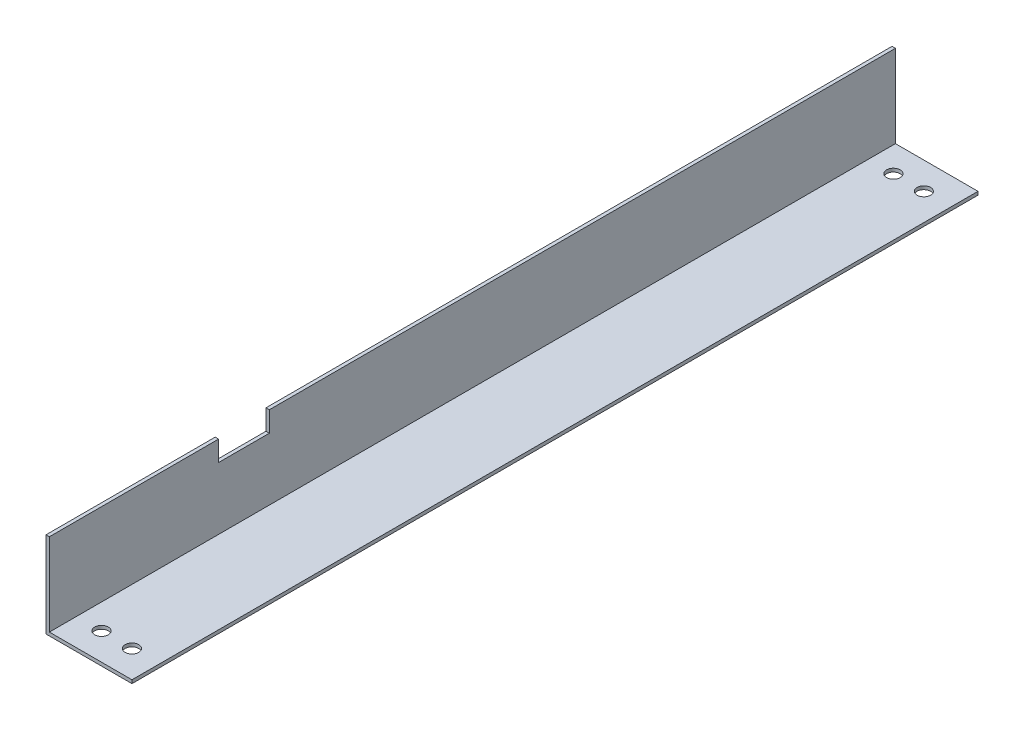
from build123d import *

# Parameters (mm, degrees)
BOSS_EXTRUDE1_DEPTH = 250
SKETCH2_R           = 2
CUT_EXTRUDE1_DEPTH  = 1
SKETCH3_W           = 15
SKETCH3_H           = 6
CUT_EXTRUDE2_DEPTH  = 1


with BuildPart() as part:
    # Sketch1 → Boss-Extrude1 (new body)
    with BuildSketch(Plane.XY):
        Polygon((0, 0), (25.4, 0), (25.4, 1), (1, 1), (1, 25.4), (0, 25.4), align=None)
    extrude(amount=-BOSS_EXTRUDE1_DEPTH)

    # Sketch2 → Cut-Extrude1 (cut)
    with BuildSketch(Plane(origin=(0, 1, 0), x_dir=(1, 0, 0), z_dir=(0, 1, 0))):
        with Locations(Location((8.4, 8, 0), (0, 0, 180))):
            Circle(SKETCH2_R)
        with Locations(Location((17.4, 8, 0), (0, 0, 180))):
            Circle(SKETCH2_R)
        with Locations(Location((8.4, 242, 0), (0, 0, 180))):
            Circle(SKETCH2_R)
        with Locations(Location((17.4, 242, 0), (0, 0, 180))):
            Circle(SKETCH2_R)
    extrude(amount=-CUT_EXTRUDE1_DEPTH, mode=Mode.SUBTRACT)

    # Sketch3 → Cut-Extrude2 (cut)
    with BuildSketch(Plane(origin=(1, 0, 0), x_dir=(0, 0, -1), z_dir=(1, 0, 0))):
        with Locations((57.5, 22.4)):
            Rectangle(SKETCH3_W, SKETCH3_H)
    extrude(amount=-CUT_EXTRUDE2_DEPTH, mode=Mode.SUBTRACT)


solid = part.part
